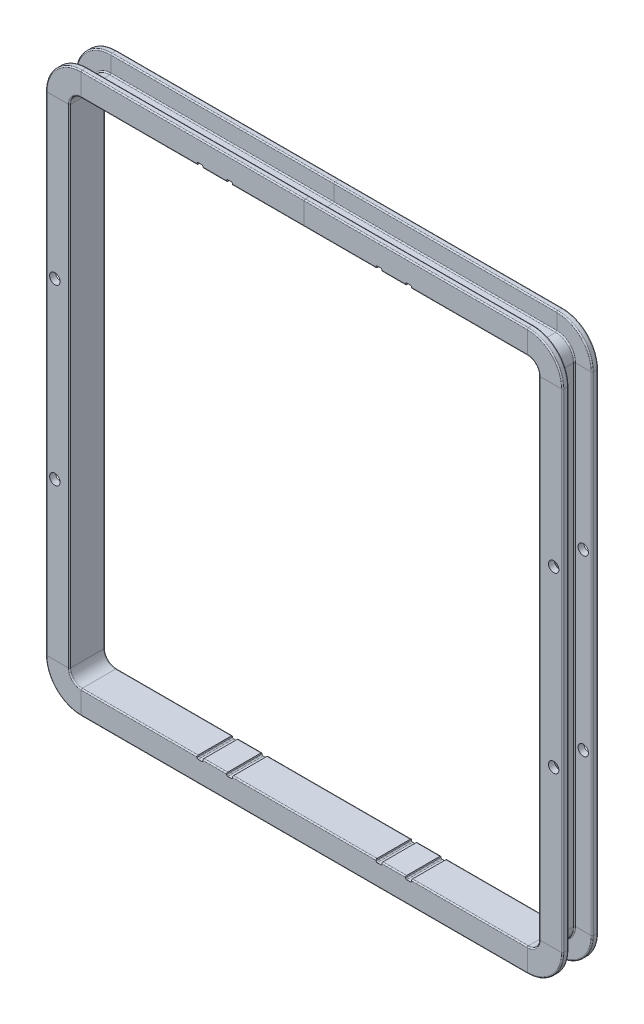
from build123d import *

# Parameters (mm, degrees)
CUT_EXTRUDE1_DEPTH      = 1461.934740785
CUT_EXTRUDE1_DEPTH_BACK = 1461.934740785
CUT_EXTRUDE4_DEPTH      = 1466.683399839
CUT_EXTRUDE4_DEPTH_BACK = 1466.683399839
SKETCH13_R              = 20


with BuildPart() as part:
    # Sweep1: sweep along a path in Sketch2
    with BuildLine(Plane.XY) as sweep1_path:
        Line((855, 980.75), (-855, 980.75))
        ThreePointArc((-855, 980.75), (-886.819805153, 967.569805153), (-900, 935.75))
        Line((-900, 935.75), (-900, -935.75))
        ThreePointArc((-900, -935.75), (-886.819805153, -967.569805153), (-855, -980.75))
        Line((-855, -980.75), (855, -980.75))
        ThreePointArc((855, -980.75), (886.819805153, -967.569805153), (900, -935.75))
        Line((900, -935.75), (900, 935.75))
        ThreePointArc((900, 935.75), (886.819805153, 967.569805153), (855, 980.75))
    # Sketch3 → Sweep1 (sweep)
    with BuildSketch(Plane(origin=(0, 0, 0), x_dir=(0, 0, -1), z_dir=(1, 0, 0))):
        with BuildLine():
            Line((-63.525, 980.75), (63.525, 980.75))
            ThreePointArc((63.525, 980.75), (66.73349702, 982.07900298), (68.0625, 985.2875))
            Line((68.0625, 985.2875), (68.0625, 1066.9625))
            ThreePointArc((68.0625, 1066.9625), (66.73349702, 1070.17099702), (63.525, 1071.5))
            Line((63.525, 1071.5), (49.9125, 1071.5))
            ThreePointArc((49.9125, 1071.5), (46.70400298, 1070.17099702), (45.375, 1066.9625))
            Line((45.375, 1066.9625), (45.375, 1007.975))
            ThreePointArc((45.375, 1007.975), (44.04599702, 1004.76650298), (40.8375, 1003.4375))
            Line((40.8375, 1003.4375), (-40.8375, 1003.4375))
            ThreePointArc((-40.8375, 1003.4375), (-44.04599702, 1004.76650298), (-45.375, 1007.975))
            Line((-45.375, 1007.975), (-45.375, 1066.9625))
            ThreePointArc((-45.375, 1066.9625), (-46.70400298, 1070.17099702), (-49.9125, 1071.5))
            Line((-49.9125, 1071.5), (-63.525, 1071.5))
            ThreePointArc((-63.525, 1071.5), (-66.73349702, 1070.17099702), (-68.0625, 1066.9625))
            Line((-68.0625, 1066.9625), (-68.0625, 985.2875))
            ThreePointArc((-68.0625, 985.2875), (-66.73349702, 982.07900298), (-63.525, 980.75))
        make_face()
    sweep(path=sweep1_path.line)

    # Sketch5 → Cut-Extrude1 (cut, two sides: drawn at the far end of the back side and taken through both)
    with BuildSketch(Plane.XY.offset(-CUT_EXTRUDE1_DEPTH_BACK)):
        with BuildLine():
            Line((-392.975, 990.75), (-406.5875, 990.75))
            ThreePointArc((-406.5875, 990.75), (-409.79599702, 989.42099702), (-411.125, 986.2125))
            Line((-411.125, 986.2125), (-411.125, 0))
            Line((-411.125, 0), (-388.4375, 0))
            Line((-388.4375, 0), (-388.4375, 986.2125))
            ThreePointArc((-388.4375, 986.2125), (-389.76650298, 989.42099702), (-392.975, 990.75))
        make_face()
        with BuildLine():
            Line((-297.6875, 0), (-275, 0))
            Line((-275, 0), (-275, 986.2125))
            ThreePointArc((-275, 986.2125), (-276.32900298, 989.42099702), (-279.5375, 990.75))
            Line((-279.5375, 990.75), (-293.15, 990.75))
            ThreePointArc((-293.15, 990.75), (-296.35849702, 989.42099702), (-297.6875, 986.2125))
            Line((-297.6875, 986.2125), (-297.6875, 0))
        make_face()
        with BuildLine():
            Line((293.15, 990.75), (279.5375, 990.75))
            ThreePointArc((279.5375, 990.75), (276.32900298, 989.42099702), (275, 986.2125))
            Line((275, 986.2125), (275, 0))
            Line((275, 0), (297.6875, 0))
            Line((297.6875, 0), (297.6875, 986.2125))
            ThreePointArc((297.6875, 986.2125), (296.35849702, 989.42099702), (293.15, 990.75))
        make_face()
        with BuildLine():
            Line((388.4375, 0), (411.125, 0))
            Line((411.125, 0), (411.125, 986.2125))
            ThreePointArc((411.125, 986.2125), (409.79599702, 989.42099702), (406.5875, 990.75))
            Line((406.5875, 990.75), (392.975, 990.75))
            ThreePointArc((392.975, 990.75), (389.76650298, 989.42099702), (388.4375, 986.2125))
            Line((388.4375, 986.2125), (388.4375, 0))
        make_face()
        with BuildLine():
            Line((-293.15, -990.75), (-279.5375, -990.75))
            ThreePointArc((-279.5375, -990.75), (-276.32900298, -989.42099702), (-275, -986.2125))
            Line((-275, -986.2125), (-275, 0))
            Line((-275, 0), (-297.6875, 0))
            Line((-297.6875, 0), (-297.6875, -986.2125))
            ThreePointArc((-297.6875, -986.2125), (-296.35849702, -989.42099702), (-293.15, -990.75))
        make_face()
        with BuildLine():
            Line((-388.4375, 0), (-411.125, 0))
            Line((-411.125, 0), (-411.125, -986.2125))
            ThreePointArc((-411.125, -986.2125), (-409.79599702, -989.42099702), (-406.5875, -990.75))
            Line((-406.5875, -990.75), (-392.975, -990.75))
            ThreePointArc((-392.975, -990.75), (-389.76650298, -989.42099702), (-388.4375, -986.2125))
            Line((-388.4375, -986.2125), (-388.4375, 0))
        make_face()
        with BuildLine():
            Line((297.6875, 0), (275, 0))
            Line((275, 0), (275, -986.2125))
            ThreePointArc((275, -986.2125), (276.32900298, -989.42099702), (279.5375, -990.75))
            Line((279.5375, -990.75), (293.15, -990.75))
            ThreePointArc((293.15, -990.75), (296.35849702, -989.42099702), (297.6875, -986.2125))
            Line((297.6875, -986.2125), (297.6875, 0))
        make_face()
        with BuildLine():
            Line((392.975, -990.75), (406.5875, -990.75))
            ThreePointArc((406.5875, -990.75), (409.79599702, -989.42099702), (411.125, -986.2125))
            Line((411.125, -986.2125), (411.125, 0))
            Line((411.125, 0), (388.4375, 0))
            Line((388.4375, 0), (388.4375, -986.2125))
            ThreePointArc((388.4375, -986.2125), (389.76650298, -989.42099702), (392.975, -990.75))
        make_face()
    extrude(amount=CUT_EXTRUDE1_DEPTH + CUT_EXTRUDE1_DEPTH_BACK, mode=Mode.SUBTRACT)

    # Sketch13 → Cut-Extrude4 (cut, two sides: drawn at the far end of the back side and taken through both)
    with BuildSketch(Plane.XY.offset(68.0625).offset(-CUT_EXTRUDE4_DEPTH_BACK)):
        with Locations((-956.2125, 330.75)):
            Circle(SKETCH13_R)
        with Locations((-956.2125, -335.2875)):
            Circle(SKETCH13_R)
        with Locations((956.2125, -335.2875)):
            Circle(SKETCH13_R)
        with Locations((956.2125, 330.75)):
            Circle(SKETCH13_R)
    extrude(amount=CUT_EXTRUDE4_DEPTH + CUT_EXTRUDE4_DEPTH_BACK, mode=Mode.SUBTRACT)


solid = part.part
